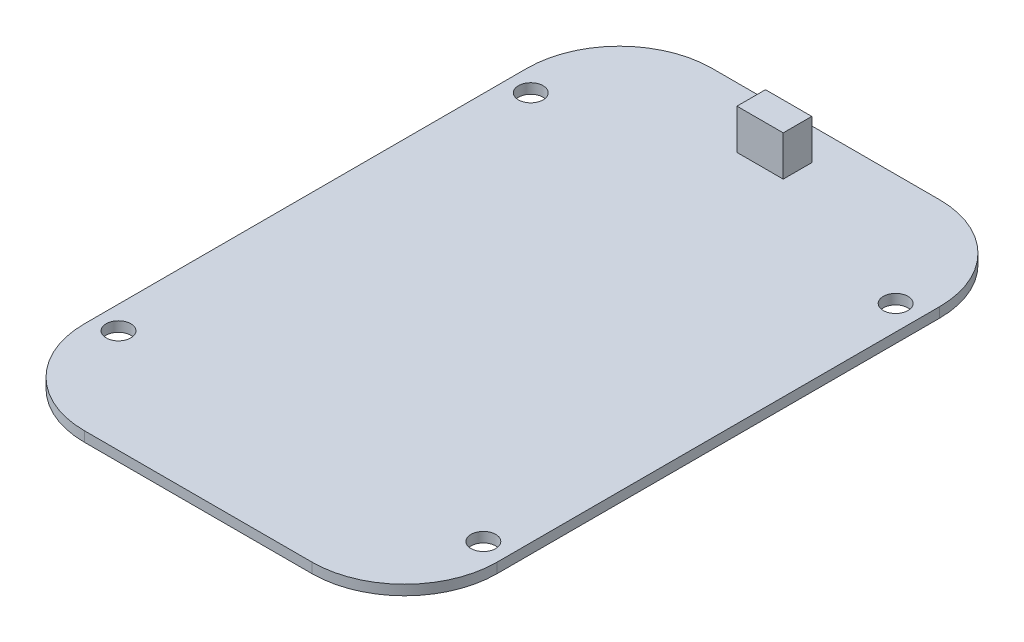
from build123d import *

# Parameters (mm, degrees)
BOSS_EXTRUDE1_DEPTH = 1.3
SKETCH2_R           = 1.6
CUT_EXTRUDE1_DEPTH  = 1.3
SKETCH3_W           = 6
SKETCH3_H           = 3.7
BOSS_EXTRUDE2_DEPTH = 5.2


with BuildPart() as part:
    # Sketch1 → Boss-Extrude1 (new body)
    with BuildSketch(Plane(origin=(0, 0, 0), x_dir=(1, 0, 0), z_dir=(0, 1, 0))):
        with BuildLine():
            Line((-20.801575534, 33.774503622), (8.728424466, 33.774503622))
            ThreePointArc((8.728424466, 33.774503622), (17.21370584, 30.259784996), (20.728424466, 21.774503622))
            Line((20.728424466, 21.774503622), (20.728424466, -35.625496378))
            ThreePointArc((20.728424466, -35.625496378), (17.21370584, -44.110777752), (8.728424466, -47.625496378))
            Line((8.728424466, -47.625496378), (-20.801575534, -47.625496378))
            ThreePointArc((-20.801575534, -47.625496378), (-29.286856908, -44.110777752), (-32.801575534, -35.625496378))
            Line((-32.801575534, -35.625496378), (-32.801575534, 21.774503622))
            ThreePointArc((-32.801575534, 21.774503622), (-29.286856908, 30.259784996), (-20.801575534, 33.774503622))
        make_face()
    extrude(amount=BOSS_EXTRUDE1_DEPTH)

    # Sketch2 → Cut-Extrude1 (cut)
    with BuildSketch(Plane(origin=(0, 1.3, 0), x_dir=(1, 0, 0), z_dir=(0, 1, 0))):
        with Locations(Location((-29.801575534, 19.274503622, 0), (0, 0, 270))):
            Circle(SKETCH2_R)
        with Locations(Location((17.518424466, 19.274503622, 0), (0, 0, 270))):
            Circle(SKETCH2_R)
        with Locations(Location((17.518424466, -34.195496378, 0), (0, 0, 270))):
            Circle(SKETCH2_R)
        with Locations(Location((-29.801575534, -34.195496378, 0), (0, 0, 270))):
            Circle(SKETCH2_R)
    extrude(amount=-CUT_EXTRUDE1_DEPTH, mode=Mode.SUBTRACT)

    # Sketch3 → Boss-Extrude2 (add)
    with BuildSketch(Plane(origin=(0, 1.3, 0), x_dir=(1, 0, 0), z_dir=(0, 1, 0))):
        with Locations((-6.731575534, 27.794503622)):
            Rectangle(SKETCH3_W, SKETCH3_H)
    extrude(amount=BOSS_EXTRUDE2_DEPTH)


solid = part.part
